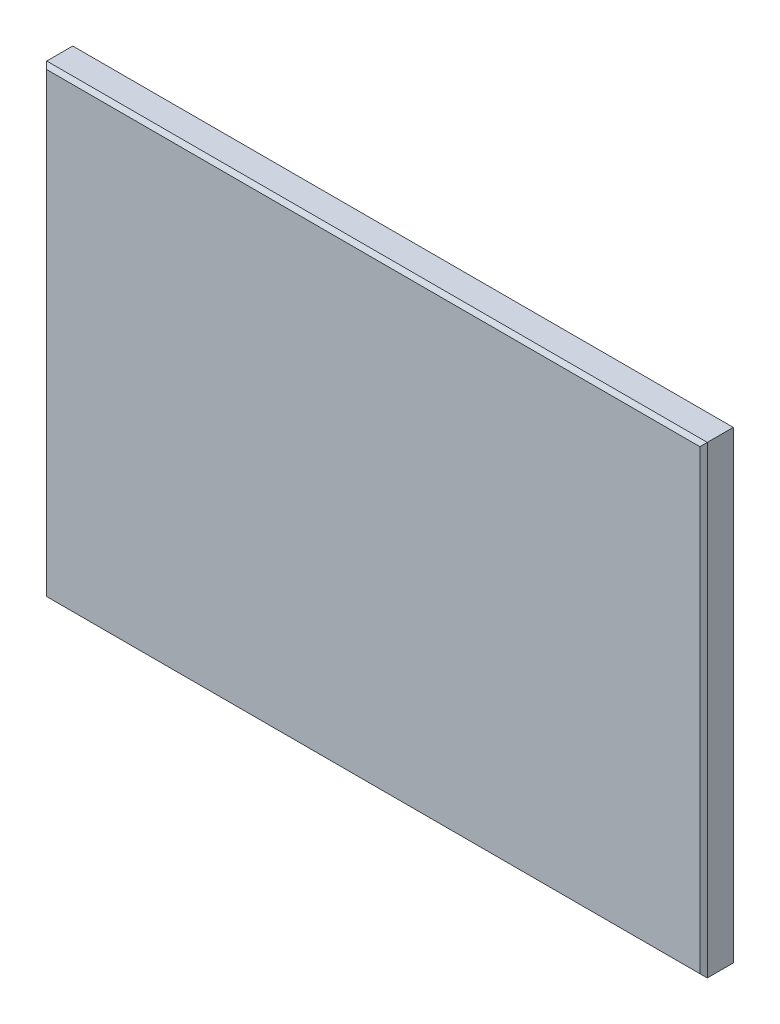
from build123d import *

# Parameters (mm, degrees)
SKETCH_1_W      = 356
SKETCH_1_H      = 250
EXTRUDE_1_DEPTH = 20
CHAMFER_1_SIZE  = 4
CHAMFER_2_SIZE  = 2


with BuildPart() as part:
    # 스케치1 → 보스-돌출1 (new body)
    with BuildSketch(Plane.XY):
        Rectangle(SKETCH_1_W, SKETCH_1_H)
    extrude(amount=EXTRUDE_1_DEPTH)

    # 모따기1
    chamfer_1_edges = [part.edges().sort_by_distance(p)[0] for p in [
        (0, 125, 0),
        (178, 0, 0),
        (0, -125, 0),
        (-178, 0, 0),
    ]]
    chamfer(chamfer_1_edges, length=CHAMFER_1_SIZE)

    # 모따기2
    chamfer_2_edges = [part.edges().sort_by_distance(p)[0] for p in [
        (178, 0, 20),
        (0, 125, 20),
        (-178, 0, 20),
        (0, -125, 20),
    ]]
    chamfer(chamfer_2_edges, length=CHAMFER_2_SIZE)


solid = part.part
